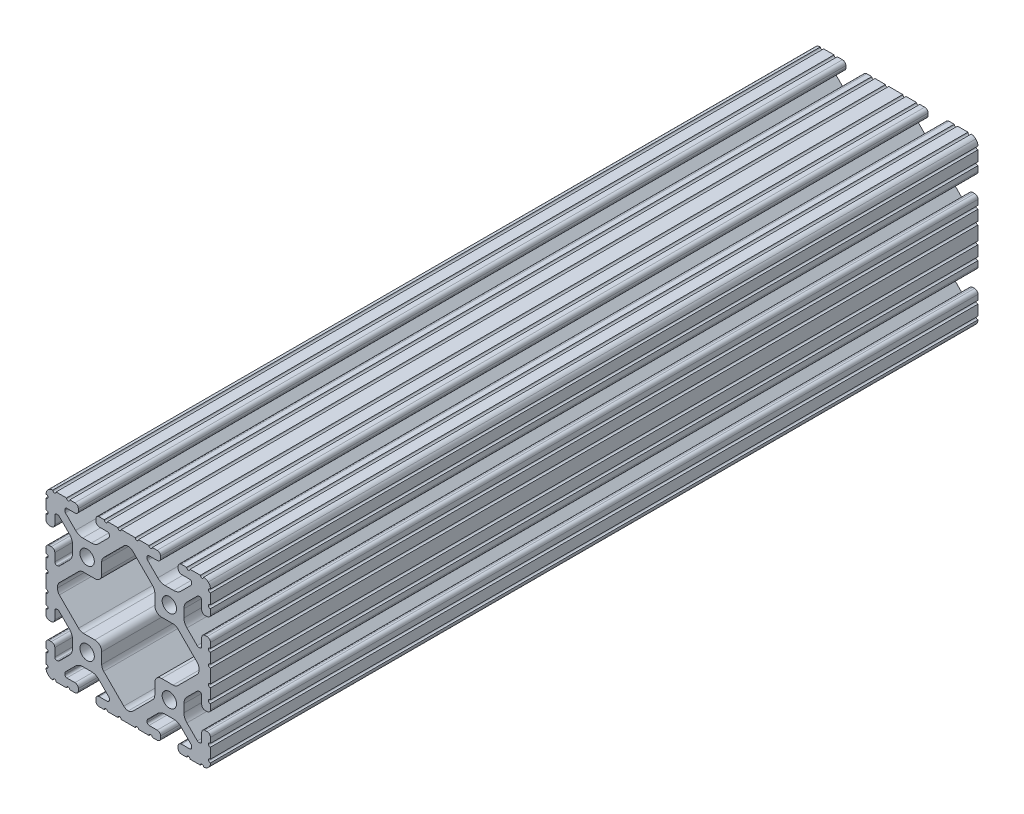
from build123d import *

# Parameters (mm, degrees)
SKETCH1_R           = 3.3274
BOSS_EXTRUDE1_DEPTH = 355.6


with BuildPart() as part:
    # Sketch1 → Boss-Extrude1 (new body)
    with BuildSketch(Plane(origin=(0, 0, -609.6), x_dir=(-1, 0, 0), z_dir=(0, 0, -1))):
        with BuildLine():
            Line((36.525200182, -23.055396049), (35.610799999, -23.055396049))
            ThreePointArc((35.610799999, -23.055396049), (34.49724824, -23.51664429), (34.035999999, -24.630196049))
            Line((34.035999999, -24.630196049), (34.035999999, -28.448000001))
            ThreePointArc((34.035999999, -28.448000001), (33.775617927, -29.07661793), (33.146999999, -29.337000001))
            Line((33.146999999, -29.337000001), (32.664287243, -29.337000001))
            ThreePointArc((32.664287243, -29.337000001), (32.324081166, -29.269328696), (32.035668541, -29.076617157))
            Line((32.035668541, -29.076617157), (27.197580079, -24.238516795))
            ThreePointArc((27.197580079, -24.238516795), (26.167955878, -22.697572205), (25.806399999, -20.879905136))
            Line((25.806399999, -20.879905136), (25.806399999, -17.220094864))
            ThreePointArc((25.806399999, -17.220094864), (26.167955878, -15.402427795), (27.197580079, -13.861483205))
            Line((27.197580079, -13.861483205), (31.948944539, -9.110107059))
            ThreePointArc((31.948944539, -9.110107059), (32.333417094, -8.853210197), (32.786933647, -8.763000001))
            Line((32.786933647, -8.763000001), (33.060275786, -8.763000001))
            ThreePointArc((33.060275786, -8.763000001), (33.750216993, -9.048783007), (34.035999999, -9.738724214))
            Line((34.035999999, -9.738724214), (34.035999999, -13.469803585))
            ThreePointArc((34.035999999, -13.469803585), (34.497248347, -14.583355602), (35.610800365, -15.044603951))
            Line((35.610800365, -15.044603951), (36.525199999, -15.044603951))
            ThreePointArc((36.525199999, -15.044603951), (37.638751758, -14.58335571), (38.099999999, -13.469803951))
            Line((38.099999999, -13.469803951), (38.099999999, -11.075039291))
            ThreePointArc((38.099999999, -11.075039291), (37.117000249, -10.313517274), (38.099999999, -9.551995256))
            Line((38.099999999, -9.551995256), (38.099999999, -4.723759309))
            ThreePointArc((38.099999999, -4.723759309), (37.117000249, -3.962237291), (38.099999999, -3.200715274))
            Line((38.099999999, -3.200715274), (38.099999999, 3.200715274))
            ThreePointArc((38.099999999, 3.200715274), (37.117000249, 3.962237291), (38.099999999, 4.723759309))
            Line((38.099999999, 4.723759309), (38.099999999, 9.551995254))
            ThreePointArc((38.099999999, 9.551995254), (37.117000249, 10.313517271), (38.099999999, 11.075039288))
            Line((38.099999999, 11.075039288), (38.099999999, 13.469803951))
            ThreePointArc((38.099999999, 13.469803951), (37.638751758, 14.58335571), (36.525199999, 15.044603951))
            Line((36.525199999, 15.044603951), (35.610800365, 15.044603951))
            ThreePointArc((35.610800365, 15.044603951), (34.497248347, 14.583355602), (34.035999999, 13.469803585))
            Line((34.035999999, 13.469803585), (34.035999999, 9.738724211))
            ThreePointArc((34.035999999, 9.738724211), (33.750216993, 9.048783004), (33.060275786, 8.762999999))
            Line((33.060275786, 8.762999999), (32.78693365, 8.762999999))
            ThreePointArc((32.78693365, 8.762999999), (32.333417097, 8.853210195), (31.948944542, 9.110107056))
            Line((31.948944542, 9.110107056), (27.197580079, 13.861483205))
            ThreePointArc((27.197580079, 13.861483205), (26.167955878, 15.402427795), (25.806399999, 17.220094864))
            Line((25.806399999, 17.220094864), (25.806399999, 20.879905136))
            ThreePointArc((25.806399999, 20.879905136), (26.167955878, 22.697572205), (27.19758008, 24.238516796))
            Line((27.19758008, 24.238516796), (32.035668541, 29.076617154))
            ThreePointArc((32.035668541, 29.076617154), (32.324081166, 29.269328694), (32.664287243, 29.336999999))
            Line((32.664287243, 29.336999999), (33.146999999, 29.336999999))
            ThreePointArc((33.146999999, 29.336999999), (33.775617927, 29.076617927), (34.035999999, 28.447999999))
            Line((34.035999999, 28.447999999), (34.035999999, 24.630196049))
            ThreePointArc((34.035999999, 24.630196049), (34.49724824, 23.51664429), (35.610799999, 23.055396049))
            Line((35.610799999, 23.055396049), (36.525200182, 23.055396049))
            ThreePointArc((36.525200182, 23.055396049), (37.638751811, 23.516644237), (38.099999999, 24.630195866))
            Line((38.099999999, 24.630195866), (38.099999999, 27.023826138))
            ThreePointArc((38.099999999, 27.023826138), (37.117780707, 27.7845421), (38.099999999, 28.545258063))
            Line((38.099999999, 28.545258063), (38.099999999, 33.373016026))
            ThreePointArc((38.099999999, 33.373016026), (37.141472622, 34.109236775), (38.1, 34.845457522))
            ThreePointArc((38.1, 34.845457522), (37.837757798, 36.120195039), (37.086123087, 37.182631848))
            ThreePointArc((37.086123087, 37.182631848), (36.106286535, 37.843374412), (34.952681874, 38.099999999))
            ThreePointArc((34.952681874, 38.099999999), (34.190730434, 37.320215334), (33.428778993, 38.099999999))
            Line((33.428778993, 38.099999999), (28.601105934, 38.099999999))
            ThreePointArc((28.601105934, 38.099999999), (27.83915858, 37.320219419), (27.077211226, 38.099999999))
            Line((27.077211226, 38.099999999), (24.688799999, 38.099999999))
            ThreePointArc((24.688799999, 38.099999999), (23.57524824, 37.638751758), (23.113999999, 36.525199999))
            Line((23.113999999, 36.525199999), (23.113999999, 35.610799999))
            ThreePointArc((23.113999999, 35.610799999), (23.57524824, 34.49724824), (24.688799999, 34.035999999))
            Line((24.688799999, 34.035999999), (28.447999999, 34.035999999))
            ThreePointArc((28.447999999, 34.035999999), (29.076617927, 33.775617927), (29.336999999, 33.146999999))
            Line((29.336999999, 33.146999999), (29.336999999, 32.720693457))
            ThreePointArc((29.336999999, 32.720693457), (29.326675076, 32.273872753), (29.100231244, 31.888543625))
            Line((29.100231244, 31.888543625), (24.409287498, 27.19758834))
            ThreePointArc((24.409287498, 27.19758834), (22.868340044, 26.167958113), (21.050667578, 25.806399999))
            Line((21.050667578, 25.806399999), (17.049332422, 25.806399999))
            ThreePointArc((17.049332422, 25.806399999), (15.231659956, 26.167958113), (13.690712502, 27.19758834))
            Line((13.690712502, 27.19758834), (9.023381297, 31.864931026))
            ThreePointArc((9.023381297, 31.864931026), (8.830670885, 32.153343115), (8.762999999, 32.493548181))
            Line((8.762999999, 32.493548181), (8.762999999, 33.146999999))
            ThreePointArc((8.762999999, 33.146999999), (9.02338207, 33.775617927), (9.651999999, 34.035999999))
            Line((9.651999999, 34.035999999), (13.411199999, 34.035999999))
            ThreePointArc((13.411199999, 34.035999999), (14.524751758, 34.49724824), (14.985999999, 35.610799999))
            Line((14.985999999, 35.610799999), (14.985999999, 36.525199999))
            ThreePointArc((14.985999999, 36.525199999), (14.524751758, 37.638751758), (13.411199999, 38.099999999))
            Line((13.411199999, 38.099999999), (11.128867073, 38.099999999))
            ThreePointArc((11.128867073, 38.099999999), (10.367071032, 37.320370692), (9.605274992, 38.099999999))
            Line((9.605274992, 38.099999999), (4.777313068, 38.099999999))
            ThreePointArc((4.777313068, 38.099999999), (4.015517027, 37.320370692), (3.253720987, 38.099999999))
            Line((3.253720987, 38.099999999), (-3.253720989, 38.099999999))
            ThreePointArc((-3.253720989, 38.099999999), (-4.01551703, 37.320370692), (-4.777313071, 38.099999999))
            Line((-4.777313071, 38.099999999), (-9.605274992, 38.099999999))
            ThreePointArc((-9.605274992, 38.099999999), (-10.367071032, 37.320370692), (-11.128867073, 38.099999999))
            Line((-11.128867073, 38.099999999), (-13.411200001, 38.099999999))
            ThreePointArc((-13.411200001, 38.099999999), (-14.52475176, 37.638751758), (-14.986000001, 36.525199999))
            Line((-14.986000001, 36.525199999), (-14.986000001, 35.610799999))
            ThreePointArc((-14.986000001, 35.610799999), (-14.52475176, 34.49724824), (-13.411200001, 34.035999999))
            Line((-13.411200001, 34.035999999), (-9.652000001, 34.035999999))
            ThreePointArc((-9.652000001, 34.035999999), (-9.023382073, 33.775617927), (-8.763000001, 33.146999999))
            Line((-8.763000001, 33.146999999), (-8.763000001, 32.493548178))
            ThreePointArc((-8.763000001, 32.493548178), (-8.830670888, 32.153343112), (-9.0233813, 31.864931023))
            Line((-9.0233813, 31.864931023), (-13.690712502, 27.19758834))
            ThreePointArc((-13.690712502, 27.19758834), (-15.231659956, 26.167958113), (-17.049332422, 25.806399999))
            Line((-17.049332422, 25.806399999), (-21.050667578, 25.806399999))
            ThreePointArc((-21.050667578, 25.806399999), (-22.868340044, 26.167958113), (-24.409287498, 27.19758834))
            Line((-24.409287498, 27.19758834), (-29.100231244, 31.888543625))
            ThreePointArc((-29.100231244, 31.888543625), (-29.326675074, 32.273872748), (-29.337000001, 32.720693446))
            Line((-29.337000001, 32.720693446), (-29.337000001, 33.146999999))
            ThreePointArc((-29.337000001, 33.146999999), (-29.07661793, 33.775617927), (-28.448000001, 34.035999999))
            Line((-28.448000001, 34.035999999), (-24.688800001, 34.035999999))
            ThreePointArc((-24.688800001, 34.035999999), (-23.575248242, 34.49724824), (-23.114000001, 35.610799999))
            Line((-23.114000001, 35.610799999), (-23.114000001, 36.525199999))
            ThreePointArc((-23.114000001, 36.525199999), (-23.575248242, 37.638751758), (-24.688800001, 38.099999999))
            Line((-24.688800001, 38.099999999), (-27.077211226, 38.099999999))
            ThreePointArc((-27.077211226, 38.099999999), (-27.83915858, 37.320219419), (-28.601105934, 38.099999999))
            Line((-28.601105934, 38.099999999), (-33.428778993, 38.099999999))
            ThreePointArc((-33.428778993, 38.099999999), (-34.190730434, 37.320215334), (-34.952681874, 38.099999999))
            ThreePointArc((-34.952681874, 38.099999999), (-36.106286561, 37.843374402), (-37.086123128, 37.18263181))
            ThreePointArc((-37.086123128, 37.18263181), (-37.837757809, 36.120195013), (-38.1, 34.845457522))
            ThreePointArc((-38.1, 34.845457522), (-37.141472622, 34.109236773), (-38.100000001, 33.373016026))
            Line((-38.100000001, 33.373016026), (-38.100000001, 28.545258062))
            ThreePointArc((-38.100000001, 28.545258062), (-37.117780707, 27.7845421), (-38.100000001, 27.023826138))
            Line((-38.100000001, 27.023826138), (-38.100000001, 24.630195866))
            ThreePointArc((-38.100000001, 24.630195866), (-37.638751814, 23.516644237), (-36.525200184, 23.055396049))
            Line((-36.525200184, 23.055396049), (-35.610800001, 23.055396049))
            ThreePointArc((-35.610800001, 23.055396049), (-34.497248242, 23.51664429), (-34.036000001, 24.630196049))
            Line((-34.036000001, 24.630196049), (-34.036000001, 28.447999999))
            ThreePointArc((-34.036000001, 28.447999999), (-33.77561793, 29.076617927), (-33.147000001, 29.336999999))
            Line((-33.147000001, 29.336999999), (-32.664287243, 29.336999999))
            ThreePointArc((-32.664287243, 29.336999999), (-32.324081166, 29.269328694), (-32.035668541, 29.076617154))
            Line((-32.035668541, 29.076617154), (-27.197580082, 24.238516798))
            ThreePointArc((-27.197580082, 24.238516798), (-26.16795588, 22.697572208), (-25.806400001, 20.879905138))
            Line((-25.806400001, 20.879905138), (-25.806400001, 17.220094862))
            ThreePointArc((-25.806400001, 17.220094862), (-26.16795588, 15.402427793), (-27.197580082, 13.861483203))
            Line((-27.197580082, 13.861483203), (-31.948944542, 9.110107056))
            ThreePointArc((-31.948944542, 9.110107056), (-32.333417097, 8.853210195), (-32.78693365, 8.762999999))
            Line((-32.78693365, 8.762999999), (-33.060275789, 8.762999999))
            ThreePointArc((-33.060275789, 8.762999999), (-33.750216996, 9.048783004), (-34.036000001, 9.738724211))
            Line((-34.036000001, 9.738724211), (-34.036000001, 13.469803585))
            ThreePointArc((-34.036000001, 13.469803585), (-34.497248349, 14.583355602), (-35.610800367, 15.044603951))
            Line((-35.610800367, 15.044603951), (-36.525200001, 15.044603951))
            ThreePointArc((-36.525200001, 15.044603951), (-37.63875176, 14.58335571), (-38.100000001, 13.469803951))
            Line((-38.100000001, 13.469803951), (-38.100000001, 11.075039288))
            ThreePointArc((-38.100000001, 11.075039288), (-37.117000249, 10.313517271), (-38.100000001, 9.551995254))
            Line((-38.100000001, 9.551995254), (-38.100000001, 4.723759308))
            ThreePointArc((-38.100000001, 4.723759308), (-37.117000249, 3.962237291), (-38.100000001, 3.200715275))
            Line((-38.100000001, 3.200715275), (-38.100000001, -3.200715275))
            ThreePointArc((-38.100000001, -3.200715275), (-37.117000249, -3.962237291), (-38.100000001, -4.723759308))
            Line((-38.100000001, -4.723759308), (-38.100000001, -9.551995257))
            ThreePointArc((-38.100000001, -9.551995257), (-37.117000249, -10.313517274), (-38.100000001, -11.07503929))
            Line((-38.100000001, -11.07503929), (-38.100000001, -13.469803951))
            ThreePointArc((-38.100000001, -13.469803951), (-37.63875176, -14.58335571), (-36.525200001, -15.044603951))
            Line((-36.525200001, -15.044603951), (-35.610800367, -15.044603951))
            ThreePointArc((-35.610800367, -15.044603951), (-34.497248349, -14.583355602), (-34.036000001, -13.469803585))
            Line((-34.036000001, -13.469803585), (-34.036000001, -9.738724214))
            ThreePointArc((-34.036000001, -9.738724214), (-33.750216996, -9.048783007), (-33.060275789, -8.763000001))
            Line((-33.060275789, -8.763000001), (-32.786933647, -8.763000001))
            ThreePointArc((-32.786933647, -8.763000001), (-32.333417094, -8.853210197), (-31.948944539, -9.110107059))
            Line((-31.948944539, -9.110107059), (-27.197580082, -13.861483203))
            ThreePointArc((-27.197580082, -13.861483203), (-26.16795588, -15.402427793), (-25.806400001, -17.220094862))
            Line((-25.806400001, -17.220094862), (-25.806400001, -20.879905138))
            ThreePointArc((-25.806400001, -20.879905138), (-26.16795588, -22.697572207), (-27.197580082, -24.238516797))
            Line((-27.197580082, -24.238516797), (-32.035668541, -29.076617157))
            ThreePointArc((-32.035668541, -29.076617157), (-32.324081166, -29.269328696), (-32.664287243, -29.337000001))
            Line((-32.664287243, -29.337000001), (-33.147000001, -29.337000001))
            ThreePointArc((-33.147000001, -29.337000001), (-33.77561793, -29.07661793), (-34.036000001, -28.448000001))
            Line((-34.036000001, -28.448000001), (-34.036000001, -24.630196049))
            ThreePointArc((-34.036000001, -24.630196049), (-34.497248242, -23.51664429), (-35.610800001, -23.055396049))
            Line((-35.610800001, -23.055396049), (-36.525200184, -23.055396049))
            ThreePointArc((-36.525200184, -23.055396049), (-37.638751814, -23.516644237), (-38.100000001, -24.630195866))
            Line((-38.100000001, -24.630195866), (-38.100000001, -27.023826138))
            ThreePointArc((-38.100000001, -27.023826138), (-37.117780707, -27.7845421), (-38.100000001, -28.545258062))
            Line((-38.100000001, -28.545258062), (-38.100000001, -33.373016026))
            ThreePointArc((-38.100000001, -33.373016026), (-37.141472622, -34.109236773), (-38.1, -34.845457522))
            ThreePointArc((-38.1, -34.845457522), (-37.83775782, -36.120194987), (-37.086123169, -37.182631771))
            ThreePointArc((-37.086123169, -37.182631771), (-36.106286588, -37.843374393), (-34.952681874, -38.100000001))
            ThreePointArc((-34.952681874, -38.100000001), (-34.190730434, -37.320215336), (-33.428778993, -38.100000001))
            Line((-33.428778993, -38.100000001), (-28.601105934, -38.100000001))
            ThreePointArc((-28.601105934, -38.100000001), (-27.83915858, -37.320219421), (-27.077211226, -38.100000001))
            Line((-27.077211226, -38.100000001), (-24.688800001, -38.100000001))
            ThreePointArc((-24.688800001, -38.100000001), (-23.575248242, -37.63875176), (-23.114000001, -36.525200001))
            Line((-23.114000001, -36.525200001), (-23.114000001, -35.610800001))
            ThreePointArc((-23.114000001, -35.610800001), (-23.575248242, -34.497248242), (-24.688800001, -34.036000001))
            Line((-24.688800001, -34.036000001), (-28.448000001, -34.036000001))
            ThreePointArc((-28.448000001, -34.036000001), (-29.07661793, -33.77561793), (-29.337000001, -33.147000001))
            Line((-29.337000001, -33.147000001), (-29.337000001, -32.720693446))
            ThreePointArc((-29.337000001, -32.720693446), (-29.326675074, -32.273872748), (-29.100231244, -31.888543625))
            Line((-29.100231244, -31.888543625), (-24.409287501, -27.197588343))
            ThreePointArc((-24.409287501, -27.197588343), (-22.868340046, -26.167958116), (-21.050667581, -25.806400001))
            Line((-21.050667581, -25.806400001), (-17.049332419, -25.806400001))
            ThreePointArc((-17.049332419, -25.806400001), (-15.231659954, -26.167958116), (-13.690712499, -27.197588343))
            Line((-13.690712499, -27.197588343), (-9.0233813, -31.864931023))
            ThreePointArc((-9.0233813, -31.864931023), (-8.830670888, -32.153343112), (-8.763000001, -32.493548178))
            Line((-8.763000001, -32.493548178), (-8.763000001, -33.147000001))
            ThreePointArc((-8.763000001, -33.147000001), (-9.023382073, -33.77561793), (-9.652000001, -34.036000001))
            Line((-9.652000001, -34.036000001), (-13.411200001, -34.036000001))
            ThreePointArc((-13.411200001, -34.036000001), (-14.52475176, -34.497248242), (-14.986000001, -35.610800001))
            Line((-14.986000001, -35.610800001), (-14.986000001, -36.525200001))
            ThreePointArc((-14.986000001, -36.525200001), (-14.52475176, -37.63875176), (-13.411200001, -38.100000001))
            Line((-13.411200001, -38.100000001), (-11.128867073, -38.100000001))
            ThreePointArc((-11.128867073, -38.100000001), (-10.367071032, -37.320370694), (-9.605274992, -38.100000001))
            Line((-9.605274992, -38.100000001), (-4.777313071, -38.100000001))
            ThreePointArc((-4.777313071, -38.100000001), (-4.01551703, -37.320370694), (-3.253720989, -38.100000001))
            Line((-3.253720989, -38.100000001), (3.253720987, -38.100000001))
            ThreePointArc((3.253720987, -38.100000001), (4.015517027, -37.320370694), (4.777313068, -38.100000001))
            Line((4.777313068, -38.100000001), (9.605274992, -38.100000001))
            ThreePointArc((9.605274992, -38.100000001), (10.367071032, -37.320370694), (11.128867073, -38.100000001))
            Line((11.128867073, -38.100000001), (13.411199999, -38.100000001))
            ThreePointArc((13.411199999, -38.100000001), (14.524751758, -37.63875176), (14.985999999, -36.525200001))
            Line((14.985999999, -36.525200001), (14.985999999, -35.610800001))
            ThreePointArc((14.985999999, -35.610800001), (14.524751758, -34.497248242), (13.411199999, -34.036000001))
            Line((13.411199999, -34.036000001), (9.651999999, -34.036000001))
            ThreePointArc((9.651999999, -34.036000001), (9.02338207, -33.77561793), (8.762999999, -33.147000001))
            Line((8.762999999, -33.147000001), (8.762999999, -32.493548181))
            ThreePointArc((8.762999999, -32.493548181), (8.830670885, -32.153343115), (9.023381297, -31.864931026))
            Line((9.023381297, -31.864931026), (13.690712499, -27.197588343))
            ThreePointArc((13.690712499, -27.197588343), (15.231659954, -26.167958116), (17.049332419, -25.806400001))
            Line((17.049332419, -25.806400001), (21.050667581, -25.806400001))
            ThreePointArc((21.050667581, -25.806400001), (22.868340046, -26.167958116), (24.409287501, -27.197588343))
            Line((24.409287501, -27.197588343), (29.100231244, -31.888543625))
            ThreePointArc((29.100231244, -31.888543625), (29.326675076, -32.273872753), (29.336999999, -32.720693457))
            Line((29.336999999, -32.720693457), (29.336999999, -33.147000001))
            ThreePointArc((29.336999999, -33.147000001), (29.076617927, -33.77561793), (28.447999999, -34.036000001))
            Line((28.447999999, -34.036000001), (24.688799999, -34.036000001))
            ThreePointArc((24.688799999, -34.036000001), (23.57524824, -34.497248242), (23.113999999, -35.610800001))
            Line((23.113999999, -35.610800001), (23.113999999, -36.525200001))
            ThreePointArc((23.113999999, -36.525200001), (23.57524824, -37.63875176), (24.688799999, -38.100000001))
            Line((24.688799999, -38.100000001), (27.077211226, -38.100000001))
            ThreePointArc((27.077211226, -38.100000001), (27.83915858, -37.320219421), (28.601105934, -38.100000001))
            Line((28.601105934, -38.100000001), (33.428778993, -38.100000001))
            ThreePointArc((33.428778993, -38.100000001), (34.190730434, -37.320215336), (34.952681874, -38.100000001))
            ThreePointArc((34.952681874, -38.100000001), (36.106286561, -37.843374403), (37.086123128, -37.182631809))
            ThreePointArc((37.086123128, -37.182631809), (37.837757809, -36.120195013), (38.1, -34.845457522))
            ThreePointArc((38.1, -34.845457522), (37.141472622, -34.109236775), (38.099999999, -33.373016026))
            Line((38.099999999, -33.373016026), (38.099999999, -28.545258063))
            ThreePointArc((38.099999999, -28.545258063), (37.117780707, -27.7845421), (38.099999999, -27.023826138))
            Line((38.099999999, -27.023826138), (38.099999999, -24.630195866))
            ThreePointArc((38.099999999, -24.630195866), (37.638751811, -23.516644237), (36.525200182, -23.055396049))
        make_face()
        with Locations(Location((19.049999999, -19.050000001, 0), (0, 0, 180))):
            Circle(SKETCH1_R, mode=Mode.SUBTRACT)
        with Locations(Location((19.049999999, 19.049999999, 0), (0, 0, 180))):
            Circle(SKETCH1_R, mode=Mode.SUBTRACT)
        with Locations(Location((-19.050000001, 19.049999999, 0), (0, 0, 180))):
            Circle(SKETCH1_R, mode=Mode.SUBTRACT)
        with Locations(Location((-19.050000001, -19.050000001, 0), (0, 0, 180))):
            Circle(SKETCH1_R, mode=Mode.SUBTRACT)
        with BuildLine():
            Line((31.902125566, -2.475607376), (23.014093535, -11.36366127))
            ThreePointArc((23.014093535, -11.36366127), (21.984048445, -12.05191677), (20.769026744, -12.293600001))
            Line((20.769026744, -12.293600001), (15.468599999, -12.293600001))
            ThreePointArc((15.468599999, -12.293600001), (13.223535968, -13.223535971), (12.293599999, -15.468600001))
            Line((12.293599999, -15.468600001), (12.293599999, -20.598259734))
            ThreePointArc((12.293599999, -20.598259734), (12.051918262, -21.813277828), (11.36366679, -22.843321004))
            Line((11.36366679, -22.843321004), (2.051515951, -32.155494748))
            ThreePointArc((2.051515951, -32.155494748), (1.11031328, -32.786013752), (0, -33.011005091))
            ThreePointArc((0, -33.011005091), (-1.11031328, -32.786013752), (-2.051515951, -32.155494748))
            Line((-2.051515951, -32.155494748), (-11.363666793, -22.843321001))
            ThreePointArc((-11.363666793, -22.843321001), (-12.051918264, -21.813277826), (-12.293600001, -20.598259732))
            Line((-12.293600001, -20.598259732), (-12.293600001, -15.468600001))
            ThreePointArc((-12.293600001, -15.468600001), (-13.223535971, -13.223535971), (-15.468600001, -12.293600001))
            Line((-15.468600001, -12.293600001), (-20.769026744, -12.293600001))
            ThreePointArc((-20.769026744, -12.293600001), (-21.984048445, -12.05191677), (-23.014093535, -11.36366127))
            Line((-23.014093535, -11.36366127), (-31.902125566, -2.475607376))
            ThreePointArc((-31.902125566, -2.475607376), (-32.607298578, -1.335259481), (-32.728725173, 0))
            ThreePointArc((-32.728725173, 0), (-32.607298578, 1.335259481), (-31.902125566, 2.475607376))
            Line((-31.902125566, 2.475607376), (-23.014093538, 11.363661268))
            ThreePointArc((-23.014093538, 11.363661268), (-21.984048448, 12.051916767), (-20.769026746, 12.293599999))
            Line((-20.769026746, 12.293599999), (-15.468600001, 12.293599999))
            ThreePointArc((-15.468600001, 12.293599999), (-13.223535971, 13.223535968), (-12.293600001, 15.468599999))
            Line((-12.293600001, 15.468599999), (-12.293600001, 20.598259732))
            ThreePointArc((-12.293600001, 20.598259732), (-12.051918264, 21.813277826), (-11.363666793, 22.843321001))
            Line((-11.363666793, 22.843321001), (-2.051515951, 32.155494748))
            ThreePointArc((-2.051515951, 32.155494748), (-1.11031328, 32.786013752), (0, 33.011005091))
            ThreePointArc((0, 33.011005091), (1.11031328, 32.786013752), (2.051515951, 32.155494748))
            Line((2.051515951, 32.155494748), (11.36366679, 22.843321004))
            ThreePointArc((11.36366679, 22.843321004), (12.051918262, 21.813277828), (12.293599999, 20.598259734))
            Line((12.293599999, 20.598259734), (12.293599999, 15.468599999))
            ThreePointArc((12.293599999, 15.468599999), (13.223535968, 13.223535968), (15.468599999, 12.293599999))
            Line((15.468599999, 12.293599999), (20.769026746, 12.293599999))
            ThreePointArc((20.769026746, 12.293599999), (21.984048448, 12.051916767), (23.014093538, 11.363661268))
            Line((23.014093538, 11.363661268), (31.902125566, 2.475607376))
            ThreePointArc((31.902125566, 2.475607376), (32.607298578, 1.335259481), (32.728725173, 0))
            ThreePointArc((32.728725173, 0), (32.607298578, -1.335259481), (31.902125566, -2.475607376))
        make_face(mode=Mode.SUBTRACT)
    extrude(amount=-BOSS_EXTRUDE1_DEPTH)


solid = part.part
